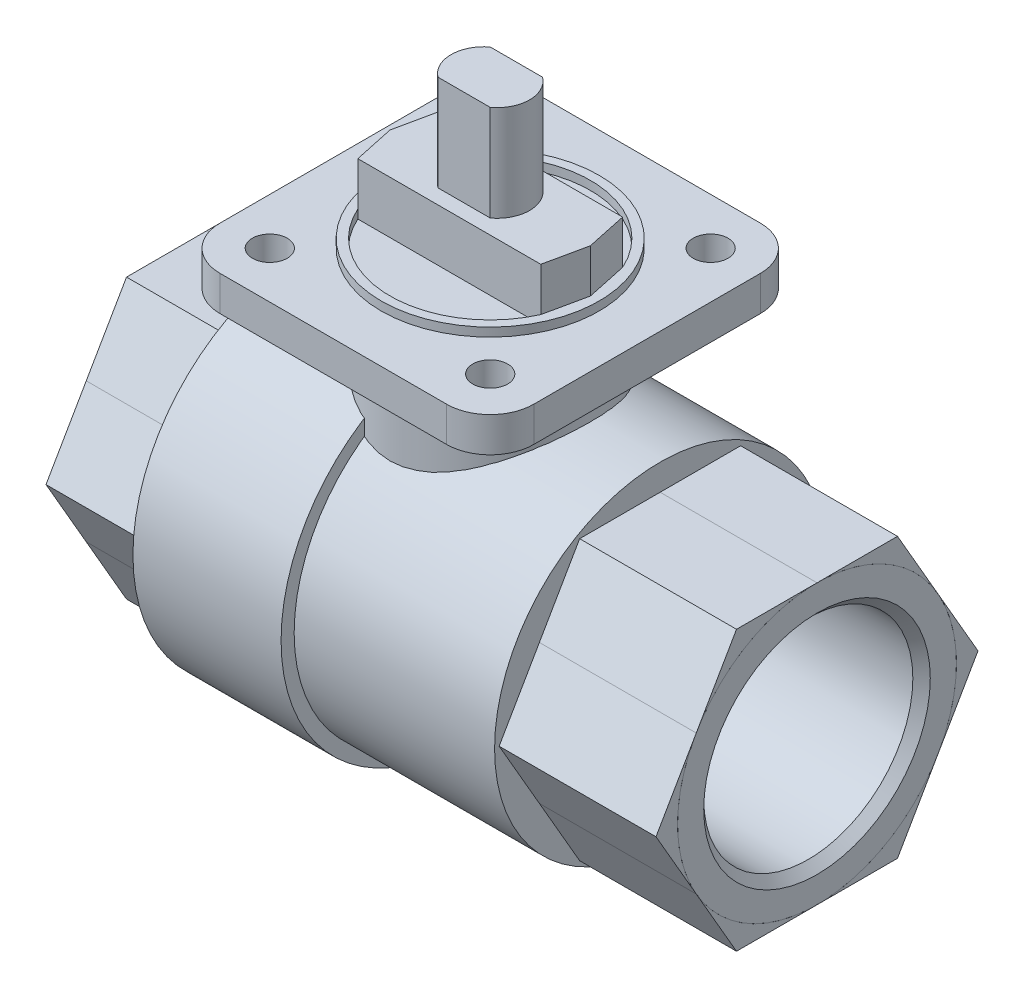
from build123d import *

# Parameters (mm, degrees)
DODANIE_WYCI_GNI_CIE2_DEPTH      = 70
DODANIE_WYCI_GNI_CIE2_2_DEPTH    = 70
DODANIE_WYCI_GNI_CIE2_3_DEPTH    = 70
DODANIE_WYCI_GNI_CIE2_4_DEPTH    = 70
DODANIE_WYCI_GNI_CIE2_5_DEPTH    = 70
DODANIE_WYCI_GNI_CIE2_6_DEPTH    = 70
ZAOKR_GLENIE2_R                  = 1
SFAZOWANIE1_SIZE                 = 1
DODANIE_WYCI_GNI_CIE3_DEPTH      = 10
DODANIE_WYCI_GNI_CIE3_DEPTH_BACK = 6
DODANIE_WYCI_GNI_CIE3_START      = 36.5
SZKIC5_R                         = 11.5
DODANIE_WYCI_GNI_CIE5_START      = 42.5
SZKIC5_12_R                      = 2
DODANIE_WYCI_GNI_CIE5_DEPTH      = 4
DODANIE_WYCI_GNI_CIE6_START      = 46.5
DODANIE_WYCI_GNI_CIE6_DEPTH      = 6
DODANIE_WYCI_GNI_CIE7_START      = 46.5
DODANIE_WYCI_GNI_CIE7_DEPTH      = 17
DODANIE_WYCI_GNI_CIE12_START     = 46.5
SZKIC7_7_R                       = 12.5
DODANIE_WYCI_GNI_CIE12_DEPTH     = 1


with BuildPart() as part:
    # Szkic1 → Obrót2 (revolve)
    with BuildSketch(Plane.XY):
        Polygon((0, 32), (0, 28), (17, 28), (17, 26), (47, 26), (47, 28), (70, 28), (70, 32), (52, 32), (52, 35), (29, 35), (29, 36.5), (12, 36.5), (12, 32), align=None)
    revolve(axis=Axis((0, 16, 0), (1, 0, 0)))

    # Zaokrąglenie2
    zaokr_glenie2_edges = [part.edges().sort_by_distance(p)[0] for p in [
        (0, 4, 0),
    ]]
    fillet(zaokr_glenie2_edges, radius=ZAOKR_GLENIE2_R)

    # Sfazowanie1
    sfazowanie1_edges = [part.edges().sort_by_distance(p)[0] for p in [
        (70, 4, 0),
    ]]
    chamfer(sfazowanie1_edges, length=SFAZOWANIE1_SIZE)


with BuildPart() as body_2:
    # Szkic2 → Dodanie-wyciągnięcie2 (new body)
    with BuildSketch(Plane(origin=(0, 0, 0), x_dir=(0, 0, -1), z_dir=(1, 0, 0))):
        with BuildLine():
            Line((13.856406207, 7.99999956), (18.475208614, 16))
            Line((18.475208614, 16), (13.856406265, 24.000000339))
            ThreePointArc((13.856406265, 24.000000339), (16, 15.999999942), (13.856406207, 7.99999956))
        make_face()
    extrude(amount=DODANIE_WYCI_GNI_CIE2_DEPTH)


with BuildPart() as body_3:
    # Szkic2 → Dodanie-wyci_gni_cie2 2 (new body)
    with BuildSketch(Plane(origin=(0, 0, 0), x_dir=(0, 0, -1), z_dir=(1, 0, 0))):
        with BuildLine():
            ThreePointArc((0, 32), (7.999999831, 29.856406558), (13.856406265, 24.000000339))
            Line((13.856406265, 24.000000339), (9.237604307, 32))
            Line((9.237604307, 32), (0, 32))
        make_face()
    extrude(amount=DODANIE_WYCI_GNI_CIE2_2_DEPTH)


with BuildPart() as body_4:
    # Szkic2 → Dodanie-wyci_gni_cie2 3 (new body)
    with BuildSketch(Plane(origin=(0, 0, 0), x_dir=(0, 0, -1), z_dir=(1, 0, 0))):
        with BuildLine():
            Line((9.237604307, 0), (13.856406207, 7.99999956))
            ThreePointArc((13.856406207, 7.99999956), (7.99999981, 2.14359343), (6.9e-08, 0))
            Line((6.9e-08, 0), (9.237604307, 0))
        make_face()
    extrude(amount=DODANIE_WYCI_GNI_CIE2_3_DEPTH)


with BuildPart() as body_5:
    # Szkic2 → Dodanie-wyci_gni_cie2 4 (new body)
    with BuildSketch(Plane(origin=(0, 0, 0), x_dir=(0, 0, -1), z_dir=(1, 0, 0))):
        with BuildLine():
            ThreePointArc((-13.856406265, 24.000000339), (-7.999999831, 29.856406558), (0, 32))
            Line((0, 32), (-9.237604307, 32))
            Line((-9.237604307, 32), (-13.856406265, 24.000000339))
        make_face()
    extrude(amount=DODANIE_WYCI_GNI_CIE2_4_DEPTH)


with BuildPart() as body_6:
    # Szkic2 → Dodanie-wyci_gni_cie2 5 (new body)
    with BuildSketch(Plane(origin=(0, 0, 0), x_dir=(0, 0, -1), z_dir=(1, 0, 0))):
        with BuildLine():
            Line((-9.237604307, 0), (6.9e-08, 0))
            ThreePointArc((6.9e-08, 0), (-7.999999954, 2.143593513), (-13.856406442, 7.999999968))
            Line((-13.856406442, 7.999999968), (-9.237604307, 0))
        make_face()
    extrude(amount=DODANIE_WYCI_GNI_CIE2_5_DEPTH)


with BuildPart() as body_7:
    # Szkic2 → Dodanie-wyci_gni_cie2 6 (new body)
    with BuildSketch(Plane(origin=(0, 0, 0), x_dir=(0, 0, -1), z_dir=(1, 0, 0))):
        with BuildLine():
            ThreePointArc((-13.856406442, 7.999999968), (-16, 16.000000177), (-13.856406265, 24.000000339))
            Line((-13.856406265, 24.000000339), (-18.475208614, 16))
            Line((-18.475208614, 16), (-13.856406442, 7.999999968))
        make_face()
    extrude(amount=DODANIE_WYCI_GNI_CIE2_6_DEPTH)


with BuildPart() as body_8:
    # Szkic5 → Dodanie-wyciągnięcie3 (new, two sides: drawn at the far end of the back side and taken through both)
    with BuildSketch(Plane(origin=(0, 0, 0), x_dir=(1, 0, 0), z_dir=(0, 1, 0)).offset(DODANIE_WYCI_GNI_CIE3_START - DODANIE_WYCI_GNI_CIE3_DEPTH_BACK)):
        with Locations((32.5, 0)):
            Circle(SZKIC5_R)
    extrude(amount=DODANIE_WYCI_GNI_CIE3_DEPTH + DODANIE_WYCI_GNI_CIE3_DEPTH_BACK)



with BuildPart() as body_9:
    # Szkic5<12> → Dodanie-wyciągnięcie5 (new body)
    with BuildSketch(Plane(origin=(0, 0, 0), x_dir=(1, 0, 0), z_dir=(0, 1, 0)).offset(DODANIE_WYCI_GNI_CIE5_START)):
        with BuildLine():
            Line((14.5, 13), (14.5, -13))
            ThreePointArc((14.5, -13), (15.964466094, -16.535533906), (19.5, -18))
            Line((19.5, -18), (45.5, -18))
            ThreePointArc((45.5, -18), (49.035533906, -16.535533906), (50.5, -13))
            Line((50.5, -13), (50.5, 13))
            ThreePointArc((50.5, 13), (49.035533906, 16.535533906), (45.5, 18))
            Line((45.5, 18), (19.5, 18))
            ThreePointArc((19.5, 18), (15.964466094, 16.535533906), (14.5, 13))
        make_face()
        with BuildLine():
            ThreePointArc((24.368272016, 8.131727984), (32.5, 11.5), (40.631727984, 8.131727984))
            ThreePointArc((40.631727984, 8.131727984), (44, 0), (40.631727984, -8.131727984))
            ThreePointArc((40.631727984, -8.131727984), (32.5, -11.5), (24.368272016, -8.131727984))
            ThreePointArc((24.368272016, -8.131727984), (21, 0), (24.368272016, 8.131727984))
        make_face(mode=Mode.SUBTRACT)
        with Locations((19.853553391, 12.646446609)):
            Circle(SZKIC5_12_R, mode=Mode.SUBTRACT)
        with Locations((19.853553391, -12.646446609)):
            Circle(SZKIC5_12_R, mode=Mode.SUBTRACT)
        with Locations((45, -12.5)):
            Circle(SZKIC5_12_R, mode=Mode.SUBTRACT)
        with Locations((45.146446609, 12.646446609)):
            Circle(SZKIC5_12_R, mode=Mode.SUBTRACT)
    extrude(amount=DODANIE_WYCI_GNI_CIE5_DEPTH)


with BuildPart() as body_10:
    # Szkic7 → Dodanie-wyciągnięcie6 (new body)
    with BuildSketch(Plane(origin=(0, 0, 0), x_dir=(1, 0, 0), z_dir=(0, 1, 0)).offset(DODANIE_WYCI_GNI_CIE6_START)):
        Polygon((22.001664113, -4.694139282), (42.998335887, -4.694139282), (44, 0), (42.998335887, 4.694139282), (22.001664113, 4.694139282), (21, 0), align=None)
        with BuildLine():
            ThreePointArc((29.5, -2.998879941), (28.009691206, 0.001120059), (29.5, 3.001120059))
            Line((29.5, 3.001120059), (35.5, 3.001120059))
            ThreePointArc((35.5, 3.001120059), (37.015454065, 0.001120059), (35.5, -2.998879941))
            Line((35.5, -2.998879941), (29.5, -2.998879941))
        make_face(mode=Mode.SUBTRACT)
    extrude(amount=DODANIE_WYCI_GNI_CIE6_DEPTH)


with BuildPart() as body_8_1:
    add(body_8.part)

    add(body_9.part)  # Dodanie-wyciągnięcie7 merges body 9

    add(body_10.part)  # Dodanie-wyciągnięcie7 merges body 10
    # Szkic7<4> → Dodanie-wyciągnięcie7 (add)
    with BuildSketch(Plane(origin=(0, 0, 0), x_dir=(1, 0, 0), z_dir=(0, 1, 0)).offset(DODANIE_WYCI_GNI_CIE7_START)):
        with BuildLine():
            ThreePointArc((29.5, 3.001120059), (28.009691206, 0.001120059), (29.5, -2.998879941))
            Line((29.5, -2.998879941), (35.5, -2.998879941))
            ThreePointArc((35.5, -2.998879941), (37.015454065, 0.001120059), (35.5, 3.001120059))
            Line((35.5, 3.001120059), (29.5, 3.001120059))
        make_face()
    extrude(amount=DODANIE_WYCI_GNI_CIE7_DEPTH)

    # Szkic7<7> → Dodanie-wyciągnięcie12 (add)
    with BuildSketch(Plane(origin=(0, 0, 0), x_dir=(1, 0, 0), z_dir=(0, 1, 0)).offset(DODANIE_WYCI_GNI_CIE12_START)):
        with Locations((32.5, 0)):
            Circle(SZKIC7_7_R)
        with BuildLine():
            Line((21, 0), (22.001664113, 4.694139282))
            ThreePointArc((22.001664113, 4.694139282), (32.5, 11.5), (42.998335887, 4.694139282))
            Line((42.998335887, 4.694139282), (44, 0))
            Line((44, 0), (42.998335887, -4.694139282))
            ThreePointArc((42.998335887, -4.694139282), (32.5, -11.5), (22.001664113, -4.694139282))
            Line((22.001664113, -4.694139282), (21, 0))
        make_face(mode=Mode.SUBTRACT)
    extrude(amount=DODANIE_WYCI_GNI_CIE12_DEPTH)


solid = Compound([part.part, body_2.part, body_3.part, body_4.part, body_5.part, body_6.part, body_7.part, body_8_1.part])
